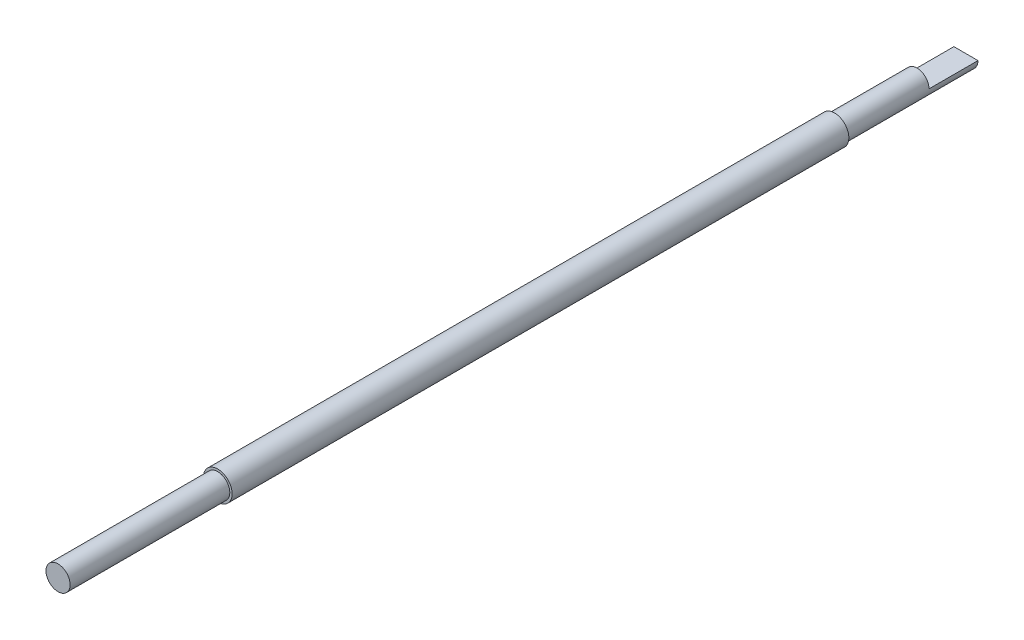
from build123d import *

# Parameters (mm, degrees)
SKETCH1_R           = 4.7625
BOSS_EXTRUDE1_DEPTH = 301.26
SKETCH3_R           = 4.7625
SKETCH3_R_2         = 4
CUT_EXTRUDE2_DEPTH  = 43.61
CUT_EXTRUDE3_DEPTH  = 16.26
CUT_EXTRUDE4_START  = -53
SKETCH5_R           = 4.7625
SKETCH5_R_2         = 4
CUT_EXTRUDE4_DEPTH  = 53


with BuildPart() as part:
    # Sketch1 → Boss-Extrude1 (new body)
    with BuildSketch(Plane.XY):
        Circle(SKETCH1_R)
    extrude(amount=BOSS_EXTRUDE1_DEPTH)

    # Sketch3 → Cut-Extrude2 (cut)
    with BuildSketch(Plane(origin=(0, 0, 0), x_dir=(-1, 0, 0), z_dir=(0, 0, -1))):
        Circle(SKETCH3_R)
        Circle(SKETCH3_R_2, mode=Mode.SUBTRACT)
    extrude(amount=-CUT_EXTRUDE2_DEPTH, mode=Mode.SUBTRACT)

    # Sketch4 → Cut-Extrude3 (cut)
    with BuildSketch(Plane(origin=(0, 0, 0), x_dir=(-1, 0, 0), z_dir=(0, 0, -1))):
        Polygon((-33.946208913, 0), (-4, 0), (4, 0), (33.946208913, 0), (33.946208913, 59.892417826), (-33.946208913, 59.892417826), align=None)
    extrude(amount=-CUT_EXTRUDE3_DEPTH, mode=Mode.SUBTRACT)

    # Sketch5 → Cut-Extrude4 (cut)
    with BuildSketch(Plane.XY.offset(301.26).offset(CUT_EXTRUDE4_START)):
        with Locations(Location((0, 0, 0), (0, 0, 180))):
            Circle(SKETCH5_R)
        with Locations(Location((0, 0, 0), (0, 0, 180))):
            Circle(SKETCH5_R_2, mode=Mode.SUBTRACT)
    extrude(amount=CUT_EXTRUDE4_DEPTH, mode=Mode.SUBTRACT)


solid = part.part
